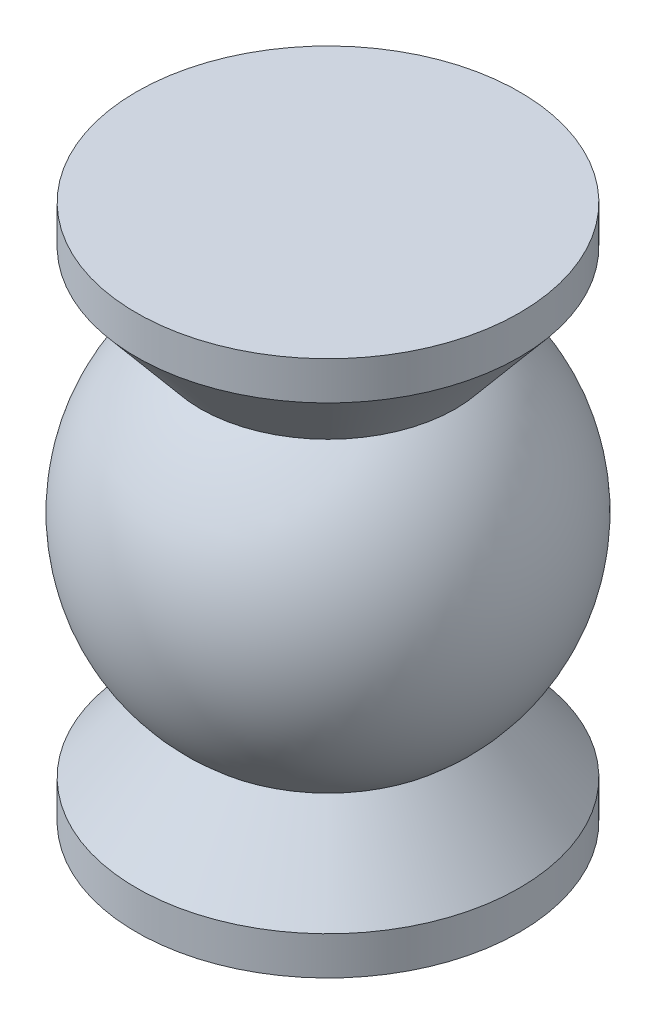
from build123d import *


with BuildPart() as part:
    # 草图1 → 旋转1 (revolve)
    with BuildSketch(Plane.XY):
        with BuildLine():
            Line((0, 0), (-25, 0))
            Line((-25, 0), (-25, -5))
            Line((-25, -5), (-16.666666667, -15))
            ThreePointArc((-16.666666667, -15), (-26.034165586, -35), (-16.666666667, -55))
            Line((-16.666666667, -55), (-25, -65))
            Line((-25, -65), (-25, -70))
            Line((-25, -70), (0, -70))
            Line((0, -70), (0, 0))
        make_face()
    revolve(axis=Axis((0, 0, 0), (0, -1, 0)))


solid = part.part
